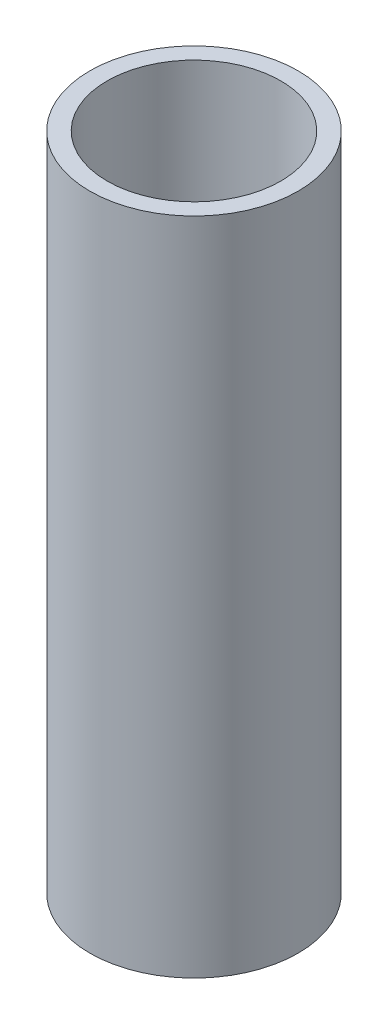
from build123d import *

# Parameters (mm, degrees)
SKETCH_1_R          = 6
EXTRUDE_1_DEPTH     = 38
SKETCH_2_R          = 5
CUT_EXTRUDE_1_DEPTH = 39.935844668


with BuildPart() as part:
    # Эскиз1 → Бобышка-Вытянуть1 (new body)
    with BuildSketch(Plane(origin=(0, 0, 0), x_dir=(1, 0, 0), z_dir=(0, 1, 0))):
        with Locations(Location((0, 0, 0), (0, 0, 270))):
            Circle(SKETCH_1_R)
    extrude(amount=EXTRUDE_1_DEPTH)

    # Эскиз2 → Вырез-Вытянуть1 (cut, through all)
    with BuildSketch(Plane(origin=(0, 38, 0), x_dir=(1, 0, 0), z_dir=(0, 1, 0))):
        with Locations(Location((0, 0, 0), (0, 0, 270))):
            Circle(SKETCH_2_R)
    extrude(amount=-CUT_EXTRUDE_1_DEPTH, mode=Mode.SUBTRACT)


solid = part.part
